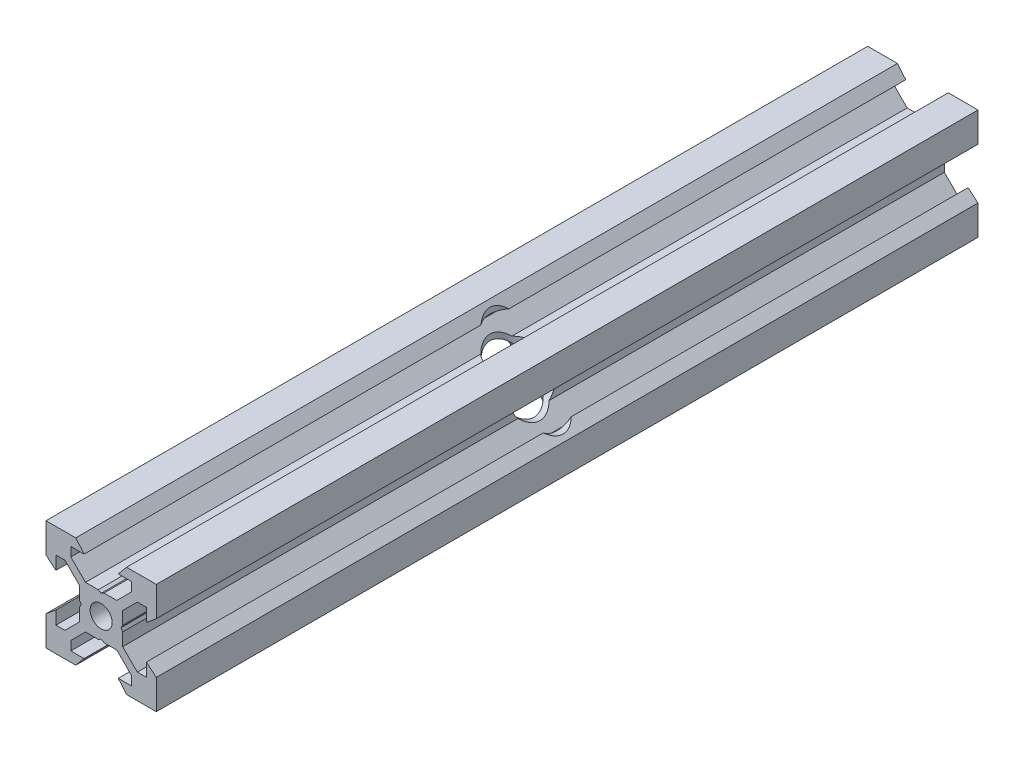
from build123d import *

# Parameters (mm, degrees)
SKETCH1_R               = 2
BOSS_EXTRUDE1_DEPTH     = 149
CUT_EXTRUDE1_DEPTH      = 150.669636199
CUT_EXTRUDE1_DEPTH_BACK = 150.669636199
SKETCH4_R               = 4
CUT_EXTRUDE2_DEPTH      = 150.669636299
CUT_EXTRUDE2_DEPTH_BACK = 150.669636299
SKETCH5_R               = 4


with BuildPart() as part:
    # Sketch1 → Boss-Extrude1 (new body)
    with BuildSketch(Plane.XY):
        Polygon((10, 10), (10, 4.610379336), (8.2, 3.1), (8.2, 5.5), (6.560660172, 5.5), (3.9, 2.839339828), (3.9, 0.519615242), (3.6, 0), (3.9, -0.519615242), (3.9, -2.839339828), (6.560660172, -5.5), (8.2, -5.5), (8.2, -3.1), (10, -4.610379336), (10, -10), (4.610379336, -10), (3.1, -8.2), (5.5, -8.2), (5.5, -6.560660172), (2.839339828, -3.9), (0.519615242, -3.9), (0, -3.6), (-0.519615242, -3.9), (-2.839339828, -3.9), (-5.5, -6.560660172), (-5.5, -8.2), (-3.1, -8.2), (-4.610379336, -10), (-10, -10), (-10, -4.610379336), (-8.2, -3.1), (-8.2, -5.5), (-6.560660172, -5.5), (-3.9, -2.839339828), (-3.9, -0.519615242), (-3.6, 0), (-3.9, 0.519615242), (-3.9, 2.839339828), (-6.560660172, 5.5), (-8.2, 5.5), (-8.2, 3.1), (-10, 4.610379336), (-10, 10), (-4.610379336, 10), (-3.1, 8.2), (-5.5, 8.2), (-5.5, 6.560660172), (-2.839339828, 3.9), (-0.519615242, 3.9), (0, 3.6), (0.519615242, 3.9), (2.839339828, 3.9), (5.5, 6.560660172), (5.5, 8.2), (3.1, 8.2), (4.610379336, 10), align=None)
        Circle(SKETCH1_R, mode=Mode.SUBTRACT)
    extrude(amount=BOSS_EXTRUDE1_DEPTH)

    # Sketch4 → Cut-Extrude1 (cut, two sides: drawn at the far end of the back side and taken through both)
    with BuildSketch(Plane(origin=(0, 0, 0), x_dir=(0, 0, -1), z_dir=(1, 0, 0)).offset(-CUT_EXTRUDE1_DEPTH_BACK)):
        with Locations((-74.5, 0)):
            Circle(SKETCH4_R)
    extrude(amount=CUT_EXTRUDE1_DEPTH + CUT_EXTRUDE1_DEPTH_BACK, mode=Mode.SUBTRACT)

    # Sketch5 → Cut-Extrude2 (cut, two sides: drawn at the far end of the back side and taken through both)
    with BuildSketch(Plane(origin=(0, 0, 0), x_dir=(1, 0, 0), z_dir=(0, 1, 0)).offset(-CUT_EXTRUDE2_DEPTH_BACK)):
        with Locations(Location((0, -74.5, 0), (0, 0, 270))):
            Circle(SKETCH5_R)
    extrude(amount=CUT_EXTRUDE2_DEPTH + CUT_EXTRUDE2_DEPTH_BACK, mode=Mode.SUBTRACT)


solid = part.part
